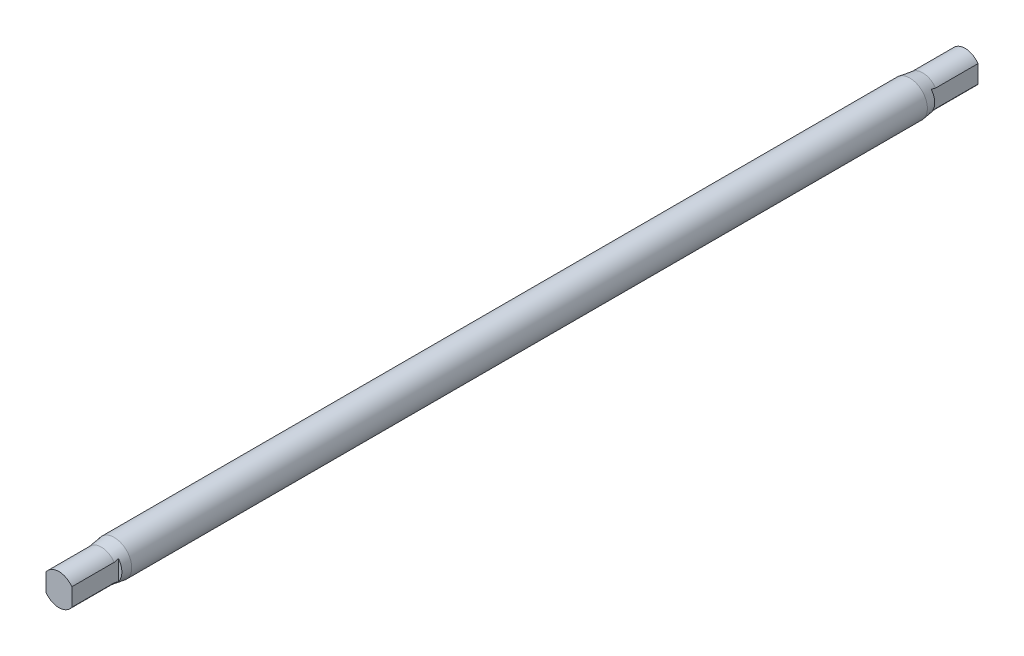
from build123d import *

# Parameters (mm, degrees)
CUT_EXTRUDE1_DEPTH      = 247.268676957
CUT_EXTRUDE1_DEPTH_BACK = 247.268676957


with BuildPart() as part:
    # Sketch2 → Revolve1 (revolve)
    with BuildSketch(Plane(origin=(0, 0, 0), x_dir=(0, 0, -1), z_dir=(1, 0, 0)), mode=Mode.PRIVATE) as revolve1_sk:
        Polygon((-215.9, 9.525), (215.9, 9.525), (222.9, 8.5), (245.9, 8.5), (245.9, 0), (215.9, 0), (215.9, 8.636), (-215.9, 8.636), (-215.9, 0), (-245.9, 0), (-245.9, 8.5), (-222.9, 8.5), align=None)
    revolve(revolve1_sk.sketch.rotate(Axis((0, 0, 215.9), (0, 0, -1)), 90), axis=Axis((0, 0, 215.9), (0, 0, -1)))

    # Sketch3 → Cut-Extrude1 (cut, two sides: drawn at the far end of the back side and taken through both)
    with BuildSketch(Plane(origin=(0, 0, 0), x_dir=(1, 0, 0), z_dir=(0, 1, 0)).offset(-CUT_EXTRUDE1_DEPTH_BACK)):
        Polygon((-7, -220.561998393), (-26.727444109, -220.561998393), (-26.727444109, -252.596471853), (37.522488539, -252.596471853), (37.522488539, -220.561998393), (7, -220.561998393), (7, -245.9), (-7, -245.9), align=None)
        Polygon((-7, 245.9), (-7, 220.561998393), (-26.727444109, 220.561998393), (-26.727444109, 252.596471853), (37.522488539, 252.596471853), (37.522488539, 220.561998393), (7, 220.561998393), (7, 245.9), align=None)
    extrude(amount=CUT_EXTRUDE1_DEPTH + CUT_EXTRUDE1_DEPTH_BACK, mode=Mode.SUBTRACT)


solid = part.part
